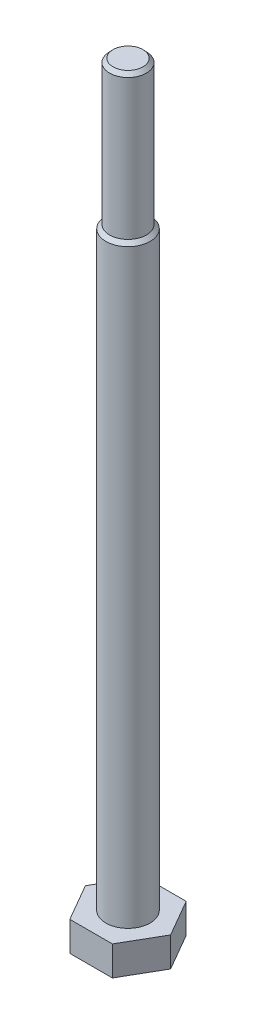
from build123d import *

# Parameters (mm, degrees)
Y_KSEKLIK_EKSTR_ZYON1_DEPTH = 4
IZIM3_R                     = 3
Y_KSEKLIK_EKSTR_ZYON2_DEPTH = 100


with BuildPart() as part:
    # Çizim2 → Yükseklik-Ekstrüzyon1 (new body)
    with BuildSketch(Plane(origin=(0, 0, 0), x_dir=(1, 0, 0), z_dir=(0, 1, 0))):
        Polygon((5.773502692, 0), (2.886751346, 5), (-2.886751346, 5), (-5.773502692, 0), (-2.886751346, -5), (2.886751346, -5), align=None)
    extrude(amount=Y_KSEKLIK_EKSTR_ZYON1_DEPTH)

    # Çizim3 → Yükseklik-Ekstrüzyon2 (add)
    with BuildSketch(Plane(origin=(0, 4, 0), x_dir=(1, 0, 0), z_dir=(0, 1, 0))):
        with Locations(Location((0, 0, 0), (0, 0, 270))):
            Circle(IZIM3_R)
    extrude(amount=Y_KSEKLIK_EKSTR_ZYON2_DEPTH)

    # Çizim4 → Kes-Döndür1 (revolve, cut)
    with BuildSketch(Plane.XY, mode=Mode.PRIVATE) as kes_d_nd_r1_sk:
        Polygon((-2.5, 103.5), (-2.5, 84.5), (-3, 84), (-5.565030224, 84), (-5.565030224, 104), (-2.5, 104), (-2.027017716, 104), align=None)
    revolve(kes_d_nd_r1_sk.sketch.rotate(Axis((0, 106.310945379, 0), (0, -1, 0)), 270), axis=Axis((0, 106.310945379, 0), (0, -1, 0)), mode=Mode.SUBTRACT)


solid = part.part
